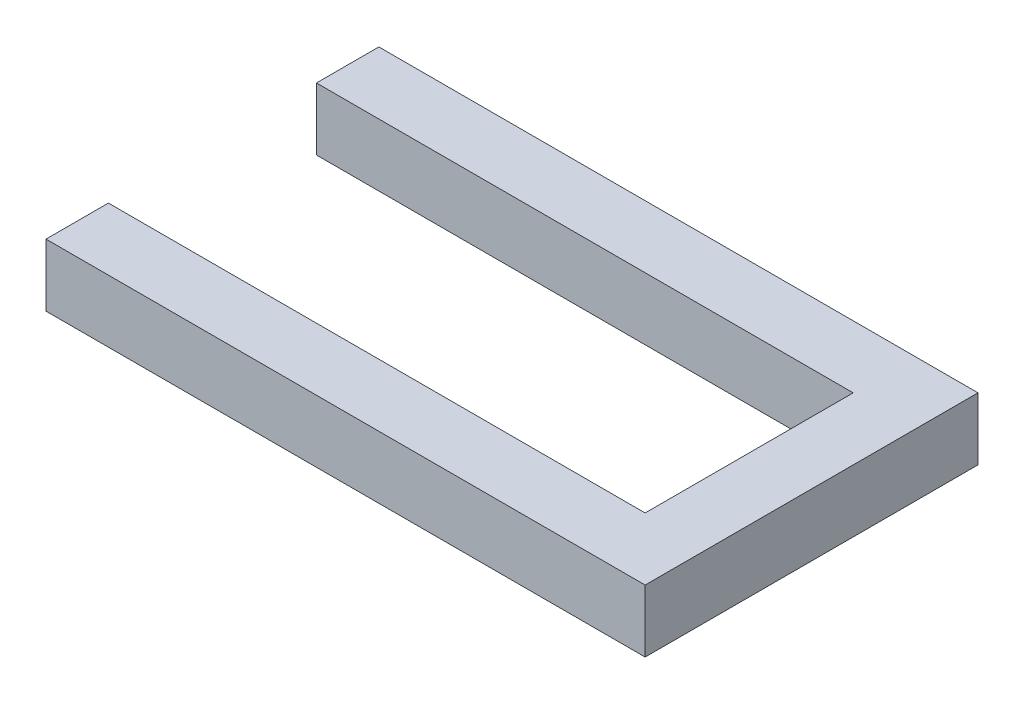
from build123d import *

# Parameters (mm, degrees)
BOSS_EXTRUDE1_DEPTH      = 101.6
BOSS_EXTRUDE1_DEPTH_BACK = 101.6
SKETCH1_W                = 38.1
SKETCH1_H                = 38.1
SKETCH2_W                = 38.1
SKETCH2_H                = 38.1
BOSS_EXTRUDE2_DEPTH      = 327.66000001


with BuildPart() as part:
    # Sketch1 → Boss-Extrude1 (new, two sides: drawn at the far end of the back side and taken through both)
    with BuildSketch(Plane.XY.offset(-BOSS_EXTRUDE1_DEPTH_BACK)):
        with Locations((-19.05, -19.05)):
            Rectangle(SKETCH1_W, SKETCH1_H)
    extrude(amount=BOSS_EXTRUDE1_DEPTH + BOSS_EXTRUDE1_DEPTH_BACK)

    # Sketch2 → Boss-Extrude2 (add)
    with BuildSketch(Plane.ZY.offset(38.1)):
        with Locations((-82.55, -19.05)):
            Rectangle(SKETCH2_W, SKETCH2_H)
        with Locations((82.55, -19.05)):
            Rectangle(SKETCH2_W, SKETCH2_H)
    extrude(amount=BOSS_EXTRUDE2_DEPTH)


solid = part.part
